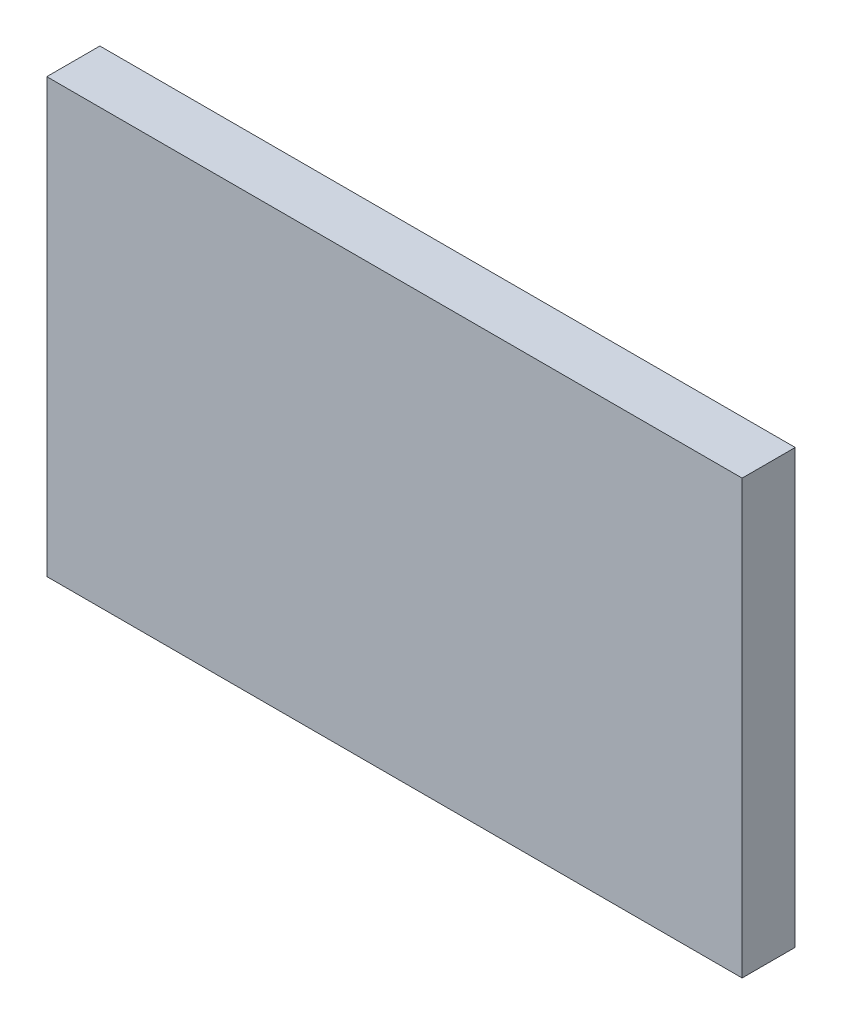
from build123d import *

# Parameters (mm, degrees)
SKIZZE1_W                       = 35.104
SKIZZE1_H                       = 21.856
AUFSATZ_LINEAR_AUSTRAGEN1_DEPTH = 2.68


with BuildPart() as part:
    # Skizze1 → Aufsatz-Linear austragen1 (new body)
    with BuildSketch(Plane.XY):
        with Locations((-0.140952381, 5.594095238)):
            Rectangle(SKIZZE1_W, SKIZZE1_H)
    extrude(amount=AUFSATZ_LINEAR_AUSTRAGEN1_DEPTH)


solid = part.part
